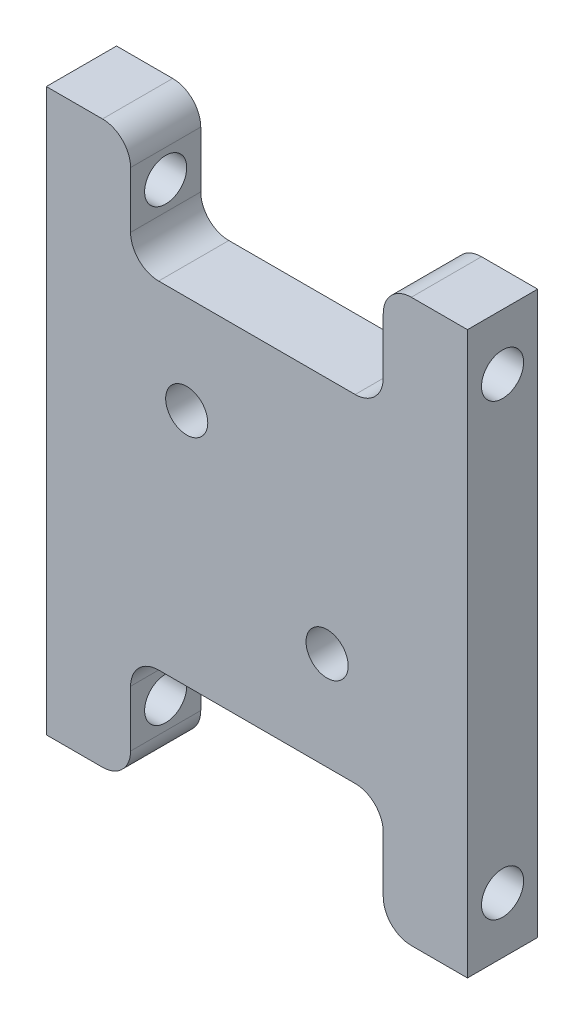
from build123d import *

# Parameters (mm, degrees)
EXTRUDE_1_DEPTH     = 5
FILLET_1_R          = 2
SKETCH_2_R          = 1.5
CUT_EXTRUDE_1_DEPTH = 26.495097568
SKETCH_6_R          = 1.5
CUT_EXTRUDE_2_DEPTH = 37.400549446


with BuildPart() as part:
    # 草图1 → 凸台-拉伸1 (new body)
    with BuildSketch(Plane.XY):
        Polygon((9, 20), (9, 12), (-9, 12), (-9, 20), (-15, 20), (-15, -20), (-9, -20), (-9, -12), (9, -12), (9, -20), (15, -20), (15, 20), align=None)
    extrude(amount=EXTRUDE_1_DEPTH)

    # 圆角1
    fillet_1_edges = [part.edges().sort_by_distance(p)[0] for p in [
        (9, -20, 2.5),
        (9, -12, 2.5),
        (-9, -12, 2.5),
        (-9, -20, 2.5),
        (-9, 20, 2.5),
        (-9, 12, 2.5),
        (9, 12, 2.5),
        (9, 20, 2.5),
    ]]
    fillet(fillet_1_edges, radius=FILLET_1_R)

    # 草图2 → 切除-拉伸1 (cut, through all)
    with BuildSketch(Plane.XY.offset(5)):
        with Locations((-5, 5)):
            Circle(SKETCH_2_R)
        with Locations(Location((5, -5, 0), (0, 0, 180))):
            Circle(SKETCH_2_R)
    extrude(amount=-CUT_EXTRUDE_1_DEPTH, mode=Mode.SUBTRACT)

    # 草图6 → 切除-拉伸2 (cut, through all)
    with BuildSketch(Plane(origin=(15, 0, 0), x_dir=(0, 0, -1), z_dir=(1, 0, 0))):
        with Locations(Location((-2.5, 16, 0), (0, 0, 90))):
            Circle(SKETCH_6_R)
        with Locations(Location((-2.5, -16, 0), (0, 0, 90))):
            Circle(SKETCH_6_R)
    extrude(amount=-CUT_EXTRUDE_2_DEPTH, mode=Mode.SUBTRACT)


solid = part.part
